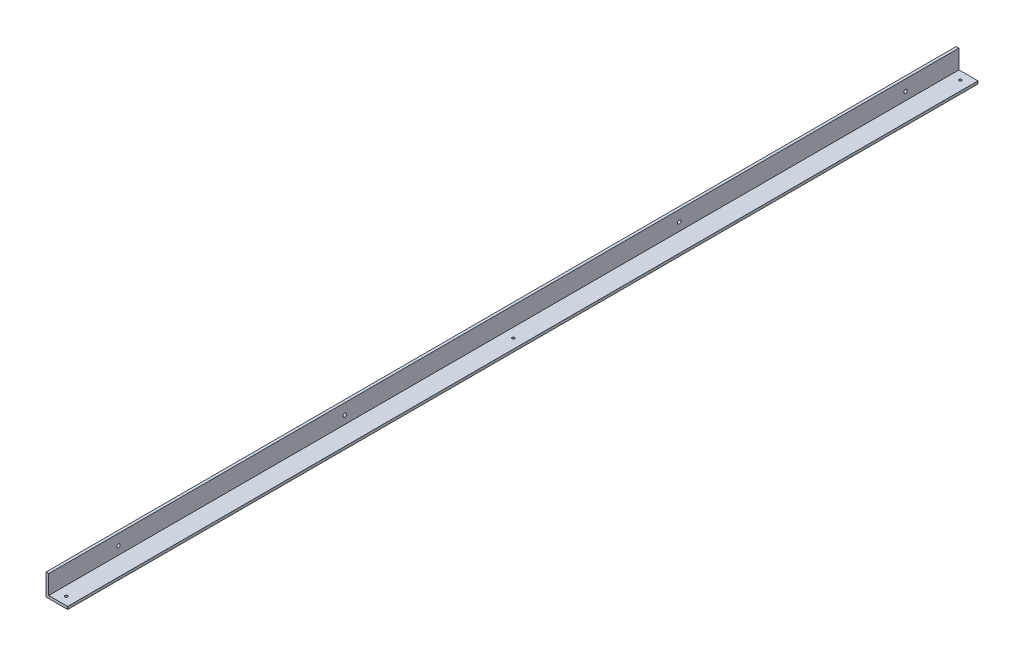
from build123d import *

# Parameters (mm, degrees)
SALIENTE_EXTRUIR1_DEPTH = 3360
CORTAR_EXTRUIR1_REACH   = 3363.904
CROQUIS2_R              = 6.35
CORTAR_EXTRUIR2_REACH   = 3363.681
CROQUIS3_R              = 4.7625


with BuildPart() as part:
    # Croquis1 → Saliente-Extruir1 (new body)
    with BuildSketch(Plane.XY):
        Polygon((0, 0), (80, 0), (80, 10), (10, 10), (10, 80), (0, 80), align=None)
    extrude(amount=SALIENTE_EXTRUIR1_DEPTH)

    # Croquis2 → Cortar-Extruir1 (cut, up to next)
    with BuildSketch(Plane.ZY, mode=Mode.PRIVATE) as cortar_extruir1_sk1:
        with Locations((3102.5, 40)):
            Circle(CROQUIS2_R)
    cortar_extruir1_tool1 = extrude(cortar_extruir1_sk1.sketch, amount=-CORTAR_EXTRUIR1_REACH, mode=Mode.PRIVATE) & part.part
    # Croquis2 → Cortar-Extruir1 (cut, up to next)
    with BuildSketch(Plane.ZY, mode=Mode.PRIVATE) as cortar_extruir1_sk2:
        with Locations((197.5, 40)):
            Circle(CROQUIS2_R)
    cortar_extruir1_tool2 = extrude(cortar_extruir1_sk2.sketch, amount=-CORTAR_EXTRUIR1_REACH, mode=Mode.PRIVATE) & part.part
    # Croquis2 → Cortar-Extruir1 (cut, up to next)
    with BuildSketch(Plane.ZY, mode=Mode.PRIVATE) as cortar_extruir1_sk3:
        with Locations((2267.5, 40)):
            Circle(CROQUIS2_R)
    cortar_extruir1_tool3 = extrude(cortar_extruir1_sk3.sketch, amount=-CORTAR_EXTRUIR1_REACH, mode=Mode.PRIVATE) & part.part
    # Croquis2 → Cortar-Extruir1 (cut, up to next)
    with BuildSketch(Plane.ZY, mode=Mode.PRIVATE) as cortar_extruir1_sk4:
        with Locations((1032.5, 40)):
            Circle(CROQUIS2_R)
    cortar_extruir1_tool4 = extrude(cortar_extruir1_sk4.sketch, amount=-CORTAR_EXTRUIR1_REACH, mode=Mode.PRIVATE) & part.part
    add(cortar_extruir1_tool1.solids().sort_by_distance((0, 40, 3102.5))[0], mode=Mode.SUBTRACT)
    add(cortar_extruir1_tool2.solids().sort_by_distance((0, 40, 197.5))[0], mode=Mode.SUBTRACT)
    add(cortar_extruir1_tool3.solids().sort_by_distance((0, 40, 2267.5))[0], mode=Mode.SUBTRACT)
    add(cortar_extruir1_tool4.solids().sort_by_distance((0, 40, 1032.5))[0], mode=Mode.SUBTRACT)

    # Croquis3 → Cortar-Extruir2 (cut, up to next)
    with BuildSketch(Plane(origin=(0, 10, 0), x_dir=(1, 0, 0), z_dir=(0, 1, 0)), mode=Mode.PRIVATE) as cortar_extruir2_sk1:
        with Locations(Location((45, -3330, 0), (0, 0, 270))):
            Circle(CROQUIS3_R)
    cortar_extruir2_tool1 = extrude(cortar_extruir2_sk1.sketch, amount=-CORTAR_EXTRUIR2_REACH, mode=Mode.PRIVATE) & part.part
    # Croquis3 → Cortar-Extruir2 (cut, up to next)
    with BuildSketch(Plane(origin=(0, 10, 0), x_dir=(1, 0, 0), z_dir=(0, 1, 0)), mode=Mode.PRIVATE) as cortar_extruir2_sk2:
        with Locations(Location((45, -1680, 0), (0, 0, 270))):
            Circle(CROQUIS3_R)
    cortar_extruir2_tool2 = extrude(cortar_extruir2_sk2.sketch, amount=-CORTAR_EXTRUIR2_REACH, mode=Mode.PRIVATE) & part.part
    # Croquis3 → Cortar-Extruir2 (cut, up to next)
    with BuildSketch(Plane(origin=(0, 10, 0), x_dir=(1, 0, 0), z_dir=(0, 1, 0)), mode=Mode.PRIVATE) as cortar_extruir2_sk3:
        with Locations(Location((45, -30, 0), (0, 0, 270))):
            Circle(CROQUIS3_R)
    cortar_extruir2_tool3 = extrude(cortar_extruir2_sk3.sketch, amount=-CORTAR_EXTRUIR2_REACH, mode=Mode.PRIVATE) & part.part
    add(cortar_extruir2_tool1.solids().sort_by_distance((45, 10, 3330))[0], mode=Mode.SUBTRACT)
    add(cortar_extruir2_tool2.solids().sort_by_distance((45, 10, 1680))[0], mode=Mode.SUBTRACT)
    add(cortar_extruir2_tool3.solids().sort_by_distance((45, 10, 30))[0], mode=Mode.SUBTRACT)


solid = part.part
